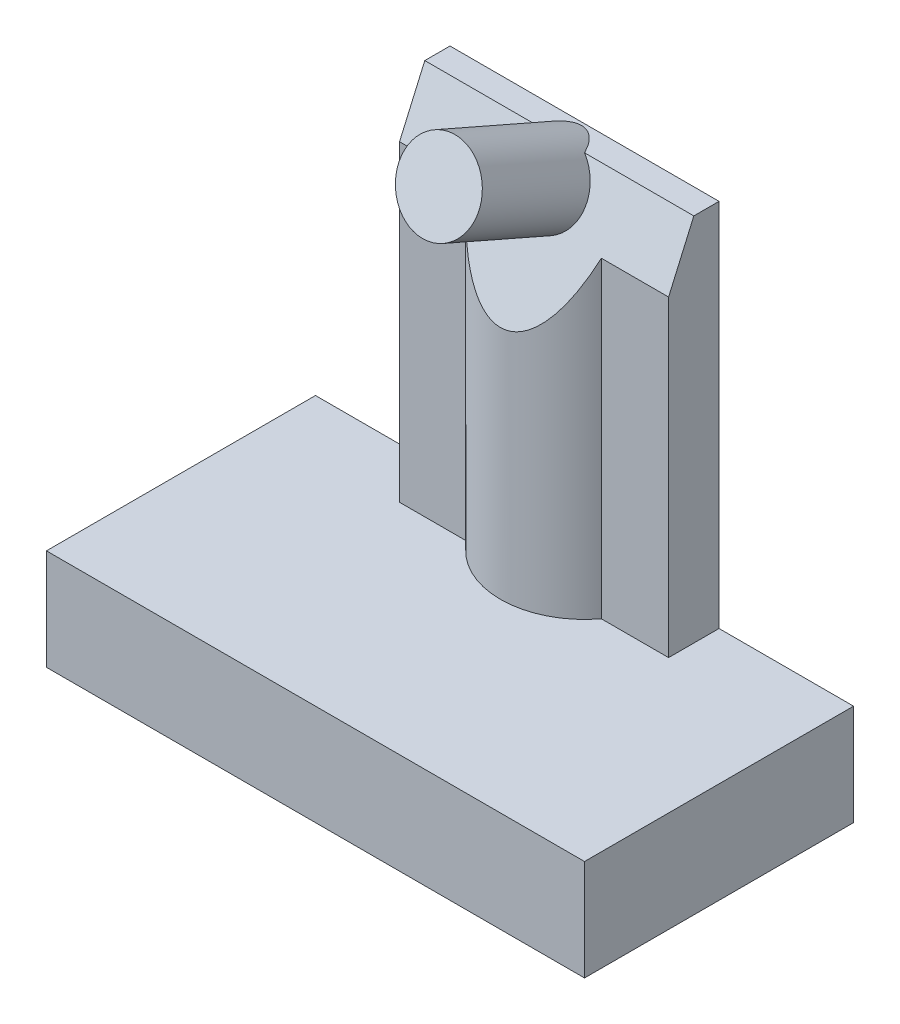
from build123d import *

# Parameters (mm, degrees)
SKETCH1_W                       = 16
SKETCH1_H                       = 8
BOSS_EXTRUDE1_DEPTH             = 3
SHELL1_T                        = -1
SKETCH2_R                       = 1.5
SKETCH2_R_2                     = 0.8
BOSS_EXTRUDE2_DEPTH             = 2
BOSS_EXTRUDE3_DEPTH             = 11
CUT_EXTRUDE1_DEPTH              = 19.867962264
BOSS_EXTRUDE4_REACH             = 18.513
SKETCH7_R                       = 1.2
BOSS_EXTRUDE4_DIRECTION_2_DEPTH = 3.5


with BuildPart() as part:
    # Sketch1 → Boss-Extrude1 (new body)
    with BuildSketch(Plane(origin=(0, 0, 0), x_dir=(1, 0, 0), z_dir=(0, 1, 0))):
        Rectangle(SKETCH1_W, SKETCH1_H)
    extrude(amount=BOSS_EXTRUDE1_DEPTH)

    # Shell1
    shell1_openings = [part.faces().sort_by_distance(p)[0] for p in [
        (0, 0, 0),
    ]]
    offset(amount=SHELL1_T, openings=shell1_openings, kind=Kind.INTERSECTION)

    # Sketch2 → Boss-Extrude2 (add)
    with BuildSketch(Plane.XZ.offset(-2)):
        Circle(SKETCH2_R)
        Circle(SKETCH2_R_2, mode=Mode.SUBTRACT)
    extrude(amount=BOSS_EXTRUDE2_DEPTH)

    # Sketch3 → Boss-Extrude3 (add)
    with BuildSketch(Plane(origin=(0, 3, 0), x_dir=(1, 0, 0), z_dir=(0, 1, 0))):
        with BuildLine():
            Line((-4, 4), (4, 4))
            Line((4, 4), (4, 2.5))
            Line((4, 2.5), (2, 2.5))
            ThreePointArc((2, 2.5), (0, 1.5), (-2, 2.5))
            Line((-2, 2.5), (-4, 2.5))
            Line((-4, 2.5), (-4, 4))
        make_face()
    extrude(amount=BOSS_EXTRUDE3_DEPTH)

    # Sketch6 → Cut-Extrude1 (cut, through all)
    with BuildSketch(Plane(origin=(4, 0, 0), x_dir=(0, 0, -1), z_dir=(1, 0, 0))):
        Polygon((3.25, 14), (1.5, 14), (1.5, 10), align=None)
    extrude(amount=-CUT_EXTRUDE1_DEPTH, mode=Mode.SUBTRACT)

    # Sketch7 → Boss-Extrude4 (add, up to next)
    with BuildSketch(Plane(origin=(0, 1.055737705, 2.413114754), x_dir=(1, 0, 0), z_dir=(0, 0.40081883401970847, 0.9161573349021889)), mode=Mode.PRIVATE) as boss_extrude4_sk1:
        with Locations((0, 13.193279121)):
            Circle(SKETCH7_R)
    boss_extrude4_tool1 = extrude(boss_extrude4_sk1.sketch, amount=-BOSS_EXTRUDE4_REACH, mode=Mode.PRIVATE) - part.part
    add(boss_extrude4_tool1.solids().sort_by_distance((0, 13.142857, -2.875))[0])

    # Sketch7 → Boss-Extrude4 direction 2 (add)
    with BuildSketch(Plane(origin=(0, 1.055737705, 2.413114754), x_dir=(1, 0, 0), z_dir=(0, 0.40081883401970847, 0.9161573349021889))):
        with Locations((0, 13.193279121)):
            Circle(SKETCH7_R)
    extrude(amount=BOSS_EXTRUDE4_DIRECTION_2_DEPTH)


solid = part.part
